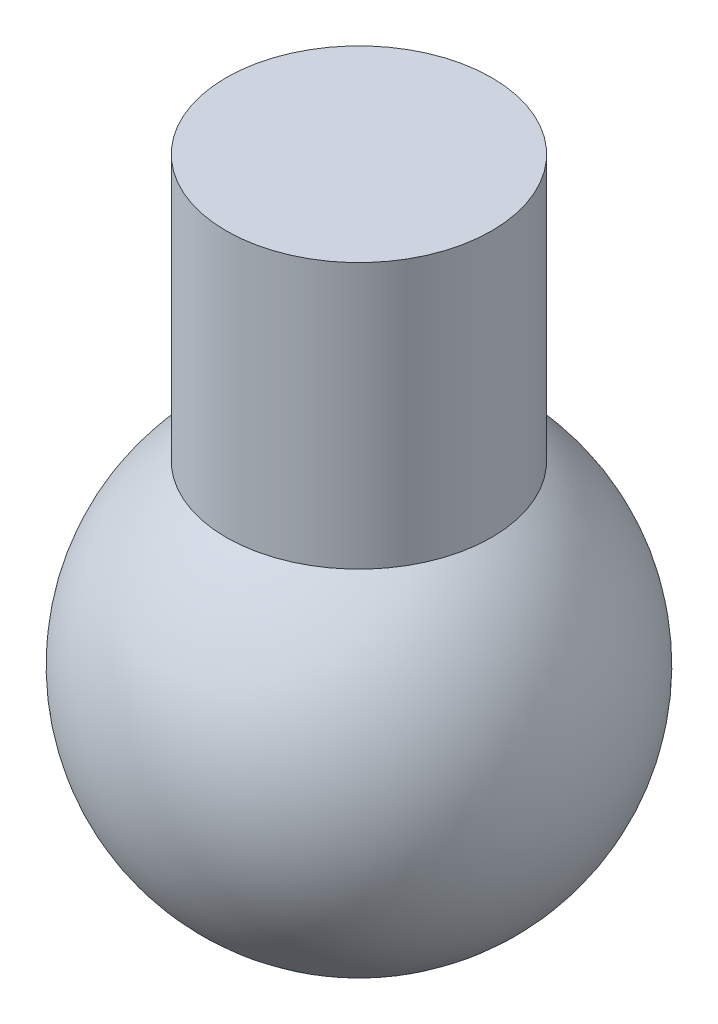
from build123d import *

# Parameters (mm, degrees)
SKETCH2_R                            = 15
BOSS_EXTRUDE1_DEPTH                  = 25
BOSS_EXTRUDE1_DIRECTION_2_REACH      = 63.237
BOSS_EXTRUDE1_DIRECTION_2_END_RADIUS = 25


with BuildPart() as part:
    # Sketch1 → Revolve1 (revolve)
    with BuildSketch(Plane.XY):
        with BuildLine():
            Line((25, 0), (-25, 0))
            ThreePointArc((-25, 0), (0, 25), (25, 0))
        make_face()
    revolve(axis=Axis((25, 0, 0), (-1, 0, 0)))

    # Sketch2 → Boss-Extrude1 (add)
    with BuildSketch(Plane(origin=(0, 25, 0), x_dir=(1, 0, 0), z_dir=(0, 1, 0))):
        with Locations(Location((0, 0, 0), (0, 0, 270))):
            Circle(SKETCH2_R)
    extrude(amount=BOSS_EXTRUDE1_DEPTH)

    # Boss-Extrude1 direction 2: up to this sphere (the profile starts outside it)
    boss_extrude1_direction_2_end = Location((0, 0, 0)) * Sphere(BOSS_EXTRUDE1_DIRECTION_2_END_RADIUS, mode=Mode.PRIVATE)
    # Sketch2 → Boss-Extrude1 direction 2 (add, up to the surface)
    with BuildSketch(Plane(origin=(0, 25, 0), x_dir=(1, 0, 0), z_dir=(0, 1, 0)), mode=Mode.PRIVATE) as boss_extrude1_direction_2_sk1:
        with Locations(Location((0, 0, 0), (0, 0, 270))):
            Circle(SKETCH2_R)
    boss_extrude1_direction_2_tool1 = extrude(boss_extrude1_direction_2_sk1.sketch, amount=-BOSS_EXTRUDE1_DIRECTION_2_REACH, mode=Mode.PRIVATE) - boss_extrude1_direction_2_end
    add(boss_extrude1_direction_2_tool1.solids().sort_by_distance((0, 25, 0))[0])


solid = part.part
